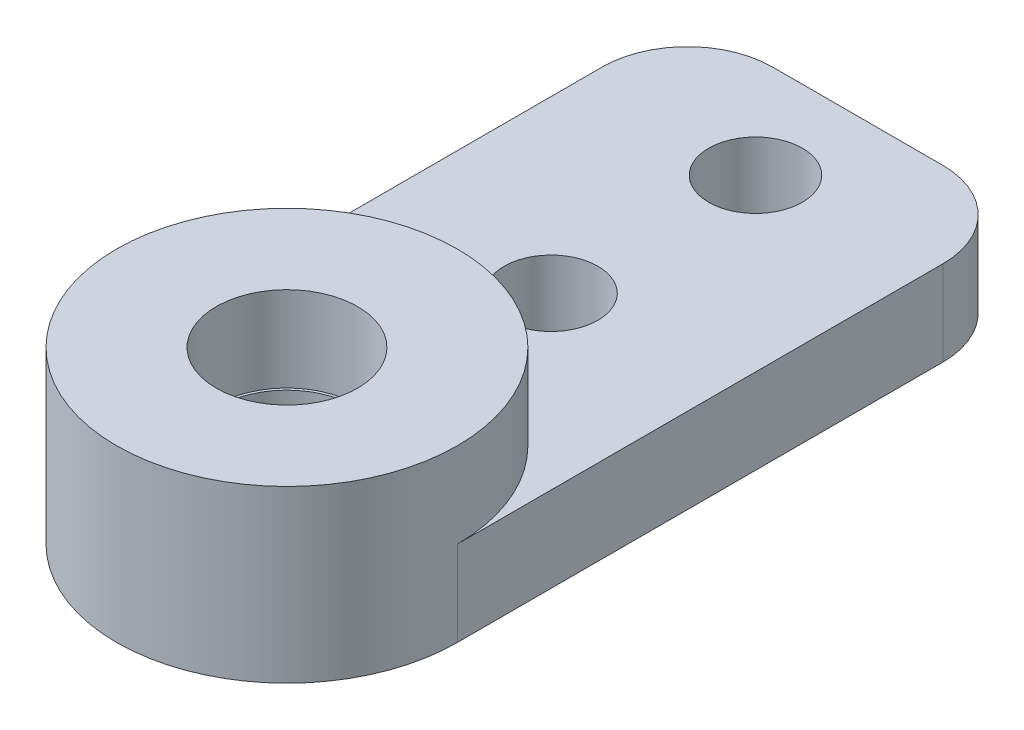
from build123d import *

# Parameters (mm, degrees)
SKETCH_1_R      = 2.75
SKETCH_1_R_2    = 4
EXTRUDE_1_DEPTH = 5
SKETCH_2_R      = 10
SKETCH_2_R_2    = 4.15
EXTRUDE_2_DEPTH = 5
FILLET_1_R      = 5


with BuildPart() as part:
    # 草图1 → 凸台-拉伸1 (new body)
    with BuildSketch(Plane(origin=(0, 0, 0), x_dir=(1, 0, 0), z_dir=(0, 1, 0))):
        with BuildLine():
            Line((10, 0), (10, 33.5))
            Line((10, 33.5), (-10, 33.5))
            Line((-10, 33.5), (-10, 0))
            ThreePointArc((-10, 0), (0, -10), (10, 0))
        make_face()
        with Locations(Location((0, 27.5, 0), (0, 0, 270))):
            Circle(SKETCH_1_R, mode=Mode.SUBTRACT)
        with Locations(Location((0, 15.5, 0), (0, 0, 270))):
            Circle(SKETCH_1_R, mode=Mode.SUBTRACT)
        with Locations(Location((0, 0, 0), (0, 0, 270))):
            Circle(SKETCH_1_R_2, mode=Mode.SUBTRACT)
    extrude(amount=EXTRUDE_1_DEPTH)

    # 草图2 → 凸台-拉伸2 (add)
    with BuildSketch(Plane(origin=(0, 5, 0), x_dir=(1, 0, 0), z_dir=(0, 1, 0))):
        Circle(SKETCH_2_R)
        with Locations(Location((0, 0, 0), (0, 0, 270))):
            Circle(SKETCH_2_R_2, mode=Mode.SUBTRACT)
    extrude(amount=EXTRUDE_2_DEPTH)

    # 圆角1
    fillet_1_edges = [part.edges().sort_by_distance(p)[0] for p in [
        (-10, 2.5, -33.5),
        (10, 2.5, -33.5),
    ]]
    fillet(fillet_1_edges, radius=FILLET_1_R)


solid = part.part
